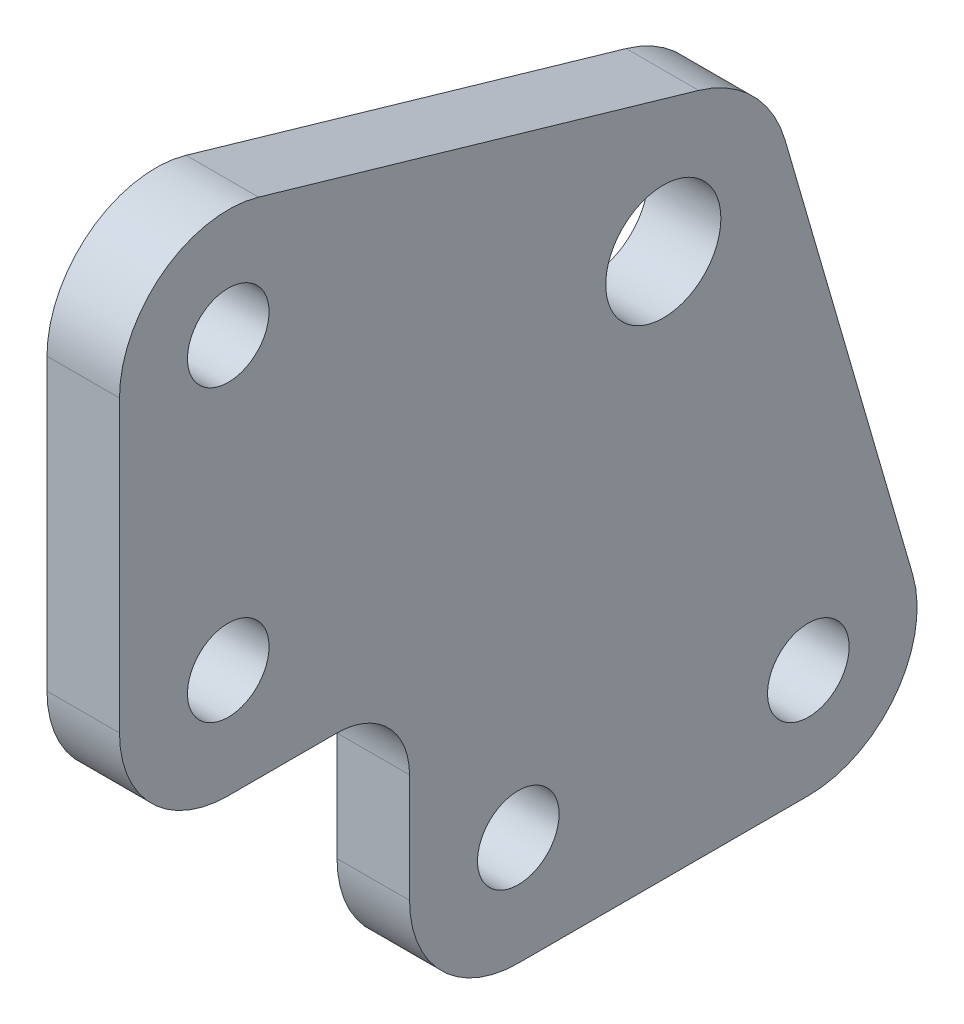
from build123d import *

# Parameters (mm, degrees)
BOSS_EXTRUDE1_START     = 12.388912
BOSS_EXTRUDE1_DEPTH     = 6.35
F_3_8_CLEARANCE_HOLE1_D = 10.0838
F_1_4_CLEARANCE_HOLE1_D = 7.14248
FILLET1_R               = 6.35


with BuildPart() as part:
    # Sketch1 → Boss-Extrude1 (new body)
    with BuildSketch(Plane(origin=(0, 0, 0), x_dir=(0, 0, -1), z_dir=(1, 0, 0)).offset(BOSS_EXTRUDE1_START)):
        with BuildLine():
            Line((-1338.000334154, 195.704574554), (-1338.000334154, 170.304574554))
            ThreePointArc((-1338.000334154, 170.304574554), (-1335.210526245, 163.569382463), (-1328.475334154, 160.779574554))
            Line((-1328.475334154, 160.779574554), (-1312.600334154, 160.779574554))
            Line((-1312.600334154, 160.779574554), (-1312.600334154, 144.904574554))
            ThreePointArc((-1312.600334154, 144.904574554), (-1309.810526245, 138.169382463), (-1303.075334154, 135.379574554))
            Line((-1303.075334154, 135.379574554), (-1277.675334154, 135.379574554))
            ThreePointArc((-1277.675334154, 135.379574554), (-1270.059858037, 139.183547679), (-1268.527125538, 147.557102426))
            Line((-1268.527125538, 147.557102426), (-1279.702424102, 186.099190405))
            ThreePointArc((-1279.702424102, 186.099190405), (-1282.517610048, 190.86229866), (-1287.280718303, 193.677484606))
            Line((-1287.280718303, 193.677484606), (-1325.822806282, 204.85278317))
            ThreePointArc((-1325.822806282, 204.85278317), (-1334.196361029, 203.320050671), (-1338.000334154, 195.704574554))
        make_face()
    extrude(amount=BOSS_EXTRUDE1_DEPTH)

    # 3/8 Clearance Hole1 (through all)
    with Locations(Plane(origin=(18.738912484, 0, 0), x_dir=(0, 0, -1), z_dir=(1, 0, 0))):
        with Locations((-1290.375334154, 183.004574554)):
            Hole(F_3_8_CLEARANCE_HOLE1_D / 2)

    # 1/4 Clearance Hole1 (through all)
    with Locations(Plane(origin=(18.738912484, 0, 0), x_dir=(0, 0, -1), z_dir=(1, 0, 0))):
        with Locations((-1303.075334154, 144.904574554), (-1277.675334154, 144.904574554), (-1328.475334154, 170.304574554), (-1328.475334154, 195.704574554)):
            Hole(F_1_4_CLEARANCE_HOLE1_D / 2)

    # Fillet1
    fillet1_edges = [part.edges().sort_by_distance(p)[0] for p in [
        (15.563912, 160.779574554, 1312.600334154),
    ]]
    fillet(fillet1_edges, radius=FILLET1_R)


solid = part.part
